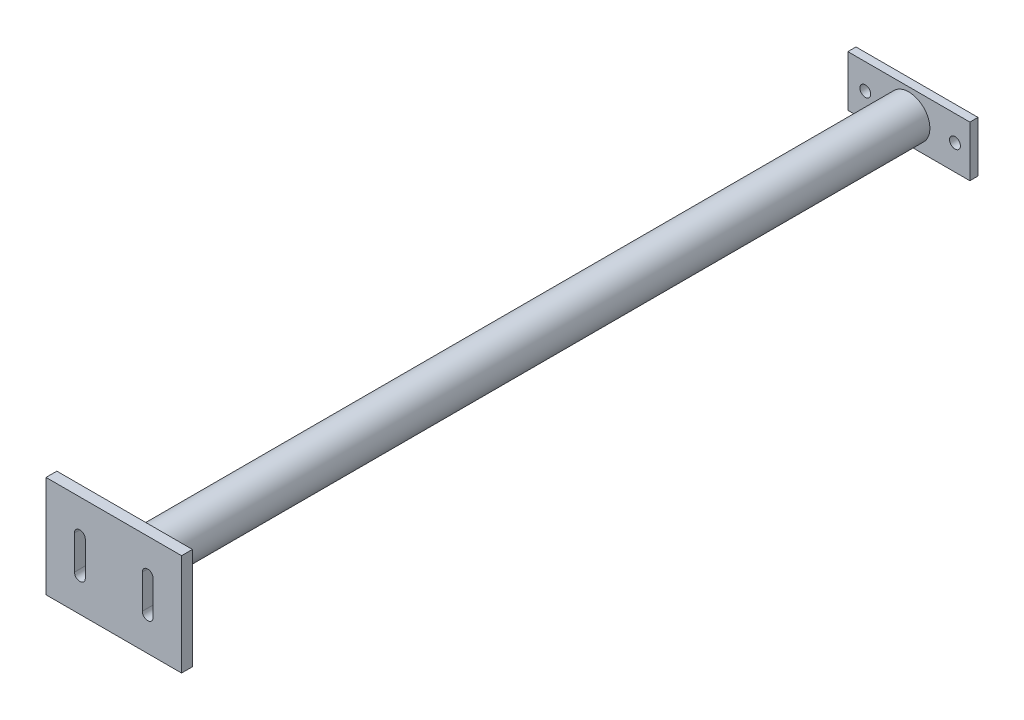
from build123d import *

# Parameters (mm, degrees)
SKETCH1_R           = 31
SKETCH1_R_2         = 25
BOSS_EXTRUDE1_DEPTH = 1157
SKETCH2_W           = 180
SKETCH2_H           = 75
SKETCH2_R           = 8
BOSS_EXTRUDE2_DEPTH = 12
SKETCH3_W           = 200
SKETCH3_H           = 150
BOSS_EXTRUDE3_DEPTH = 16


with BuildPart() as part:
    # Sketch1 → Boss-Extrude1 (new body)
    with BuildSketch(Plane.XY):
        Circle(SKETCH1_R)
        Circle(SKETCH1_R_2, mode=Mode.SUBTRACT)
    extrude(amount=BOSS_EXTRUDE1_DEPTH)

    # Sketch2 → Boss-Extrude2 (add)
    with BuildSketch(Plane(origin=(0, 0, 0), x_dir=(-1, 0, 0), z_dir=(0, 0, -1))):
        Rectangle(SKETCH2_W, SKETCH2_H)
        with Locations((64.227589169, 0)):
            Circle(SKETCH2_R, mode=Mode.SUBTRACT)
        with Locations((-68.030538528, 0)):
            Circle(SKETCH2_R, mode=Mode.SUBTRACT)
    extrude(amount=BOSS_EXTRUDE2_DEPTH)

    # Sketch3 → Boss-Extrude3 (add)
    with BuildSketch(Plane.XY.offset(1157)):
        Rectangle(SKETCH3_W, SKETCH3_H)
        with BuildLine():
            Line((-42, 25), (-42, -25))
            ThreePointArc((-42, -25), (-50, -33), (-58, -25))
            Line((-58, -25), (-58, 25))
            ThreePointArc((-58, 25), (-50, 33), (-42, 25))
        make_face(mode=Mode.SUBTRACT)
        with BuildLine():
            Line((42, 25), (42, -25))
            ThreePointArc((42, -25), (50, -33), (58, -25))
            Line((58, -25), (58, 25))
            ThreePointArc((58, 25), (50, 33), (42, 25))
        make_face(mode=Mode.SUBTRACT)
    extrude(amount=BOSS_EXTRUDE3_DEPTH)


solid = part.part
